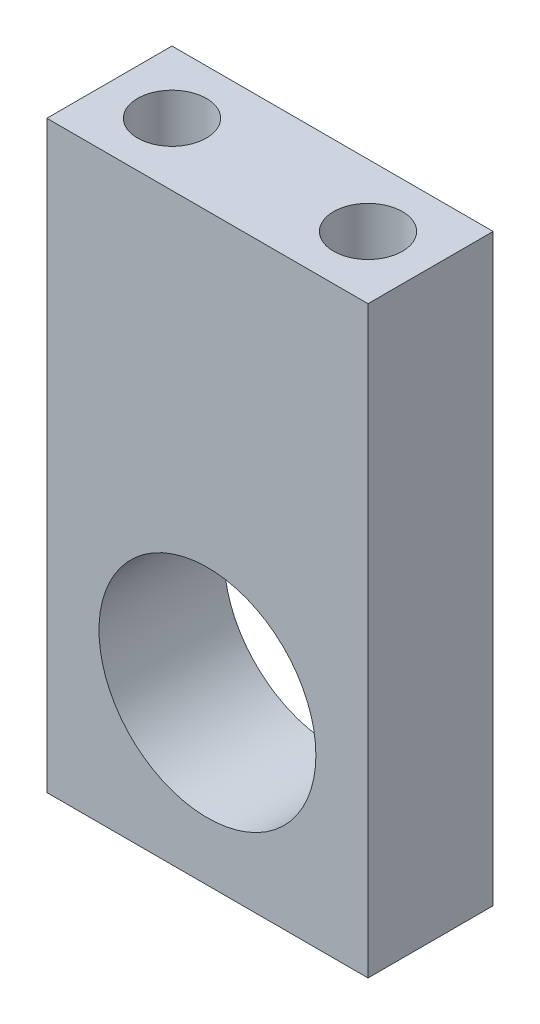
from build123d import *

# Parameters (mm, degrees)
SKETCH1_W                                     = 15.4
SKETCH1_H                                     = 6
BOSS_EXTRUDE1_DEPTH                           = 28
TAP_DRILL_FOR_M4X0_7_TAP1_D                   = 3.3
TAP_DRILL_FOR_M4X0_7_TAP1_DEPTH               = 13.4
TAP_DRILL_FOR_M4X0_7_TAP1_TIP                 = 0.991420021
CUT_EXTRUDE_PRESS_FIT_HOLE_FOR_SOLENOID_REACH = 31.653
SKETCH4_R                                     = 5.2
TAP_DRILL_FOR_M4X0_7_TAP2_D                   = 3.3
TAP_DRILL_FOR_M4X0_7_TAP2_DEPTH               = 3
TAP_DRILL_FOR_M4X0_7_TAP2_TIP                 = 0.991420021


with BuildPart() as part:
    # Sketch1 → Boss-Extrude1 (new body)
    with BuildSketch(Plane(origin=(0, 0, 0), x_dir=(1, 0, 0), z_dir=(0, 1, 0))):
        Rectangle(SKETCH1_W, SKETCH1_H)
    extrude(amount=BOSS_EXTRUDE1_DEPTH)

    # Tap Drill for M4x0.7 Tap1
    with Locations(Plane(origin=(-4.7, 28, 0), x_dir=(0, 0, 1), z_dir=(0, 1, 0))):
        with Locations((0, 0), (0, 9.4)):
            Hole(TAP_DRILL_FOR_M4X0_7_TAP1_D / 2, depth=TAP_DRILL_FOR_M4X0_7_TAP1_DEPTH)
            with Locations((0, 0, -(TAP_DRILL_FOR_M4X0_7_TAP1_DEPTH + TAP_DRILL_FOR_M4X0_7_TAP1_TIP / 2))):  # 118° drill point
                Cone(0, TAP_DRILL_FOR_M4X0_7_TAP1_D / 2, TAP_DRILL_FOR_M4X0_7_TAP1_TIP, mode=Mode.SUBTRACT)

    # Sketch4 → Cut-Extrude Press Fit hole for solenoid tube (cut, up to next)
    with BuildSketch(Plane.XY.offset(3), mode=Mode.PRIVATE) as cut_extrude_press_fit_hole_for_solenoid_sk1:
        with Locations((0, 8)):
            Circle(SKETCH4_R)
    cut_extrude_press_fit_hole_for_solenoid_tool1 = extrude(cut_extrude_press_fit_hole_for_solenoid_sk1.sketch, amount=-CUT_EXTRUDE_PRESS_FIT_HOLE_FOR_SOLENOID_REACH, mode=Mode.PRIVATE) & part.part
    add(cut_extrude_press_fit_hole_for_solenoid_tool1.solids().sort_by_distance((0, 8, 3))[0], mode=Mode.SUBTRACT)

    # Tap Drill for M4x0.7 Tap2
    with Locations(Plane(origin=(0, 0, 0), x_dir=(-1, 0, 0), z_dir=(0, -1, 0))):
        with Locations((-4.7, 0), (4.7, 0)):
            Hole(TAP_DRILL_FOR_M4X0_7_TAP2_D / 2, depth=TAP_DRILL_FOR_M4X0_7_TAP2_DEPTH)
            with Locations((0, 0, -(TAP_DRILL_FOR_M4X0_7_TAP2_DEPTH + TAP_DRILL_FOR_M4X0_7_TAP2_TIP / 2))):  # 118° drill point
                Cone(0, TAP_DRILL_FOR_M4X0_7_TAP2_D / 2, TAP_DRILL_FOR_M4X0_7_TAP2_TIP, mode=Mode.SUBTRACT)


solid = part.part
